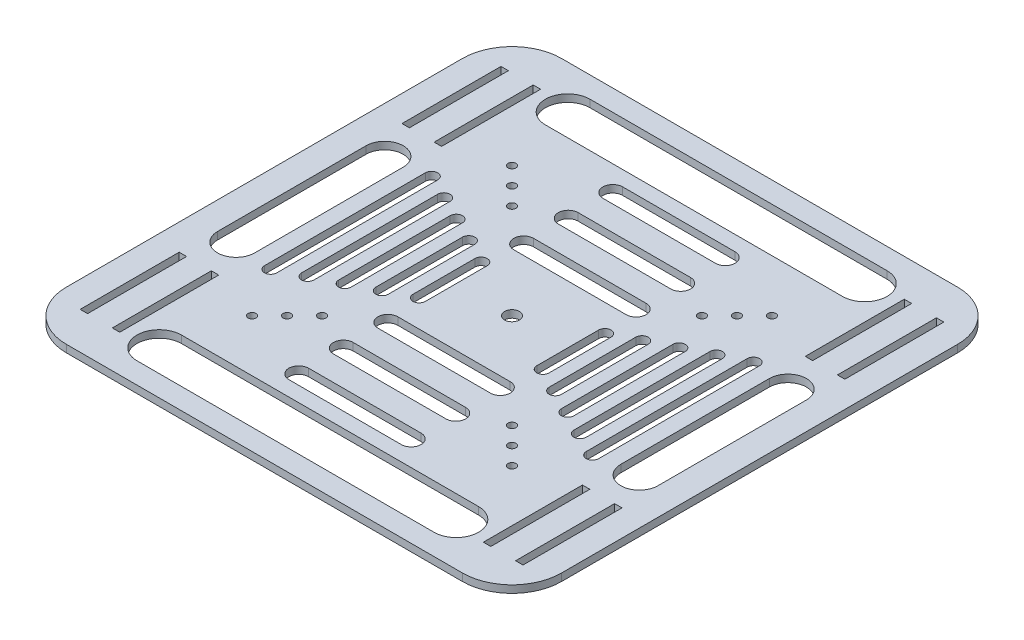
from build123d import *

# Parameters (mm, degrees)
SKETCH_2_W      = 200
SKETCH_2_H      = 200
SKETCH_2_R      = 1.6
SKETCH_2_R_2    = 3
SKETCH_2_W_2    = 3
SKETCH_2_H_2    = 40
EXTRUDE_1_DEPTH = 3
FILLET_2_R      = 20


with BuildPart() as part:
    # 草图2 → 凸台-拉伸1 (new body)
    with BuildSketch(Plane(origin=(0, 0, 0), x_dir=(1, 0, 0), z_dir=(0, 1, 0))):
        Rectangle(SKETCH_2_W, SKETCH_2_H)
        with Locations(Location((-52.5, 52.5, 0), (0, 0, 270))):
            Circle(SKETCH_2_R, mode=Mode.SUBTRACT)
        with Locations(Location((-45.428932188, 45.428932188, 0), (0, 0, 270))):
            Circle(SKETCH_2_R, mode=Mode.SUBTRACT)
        with Locations(Location((-38.357864376, 38.357864376, 0), (0, 0, 270))):
            Circle(SKETCH_2_R, mode=Mode.SUBTRACT)
        with Locations(Location((52.5, 52.5, 0), (0, 0, 270))):
            Circle(SKETCH_2_R, mode=Mode.SUBTRACT)
        with Locations(Location((45.428932188, 45.428932188, 0), (0, 0, 270))):
            Circle(SKETCH_2_R, mode=Mode.SUBTRACT)
        with Locations(Location((38.357864376, 38.357864376, 0), (0, 0, 270))):
            Circle(SKETCH_2_R, mode=Mode.SUBTRACT)
        with Locations(Location((52.5, -52.5, 0), (0, 0, 270))):
            Circle(SKETCH_2_R, mode=Mode.SUBTRACT)
        with Locations(Location((45.428932188, -45.428932188, 0), (0, 0, 270))):
            Circle(SKETCH_2_R, mode=Mode.SUBTRACT)
        with Locations(Location((38.357864376, -38.357864376, 0), (0, 0, 270))):
            Circle(SKETCH_2_R, mode=Mode.SUBTRACT)
        with Locations(Location((-52.5, -52.5, 0), (0, 0, 270))):
            Circle(SKETCH_2_R, mode=Mode.SUBTRACT)
        with Locations(Location((-45.428932188, -45.428932188, 0), (0, 0, 270))):
            Circle(SKETCH_2_R, mode=Mode.SUBTRACT)
        with Locations(Location((-38.357864376, -38.357864376, 0), (0, 0, 270))):
            Circle(SKETCH_2_R, mode=Mode.SUBTRACT)
        with Locations(Location((0, 0, 0), (0, 0, 270))):
            Circle(SKETCH_2_R_2, mode=Mode.SUBTRACT)
        with BuildLine():
            Line((-60, 73.5), (60, 73.5))
            ThreePointArc((60, 73.5), (69, 82.5), (60, 91.5))
            Line((60, 91.5), (-60, 91.5))
            ThreePointArc((-60, 91.5), (-69, 82.5), (-60, 73.5))
        make_face(mode=Mode.SUBTRACT)
        with BuildLine():
            Line((-60, -73.5), (60, -73.5))
            ThreePointArc((60, -73.5), (69, -82.5), (60, -91.5))
            Line((60, -91.5), (-60, -91.5))
            ThreePointArc((-60, -91.5), (-69, -82.5), (-60, -73.5))
        make_face(mode=Mode.SUBTRACT)
        with Locations((74.942911166, 65)):
            Rectangle(SKETCH_2_W_2, SKETCH_2_H_2, mode=Mode.SUBTRACT)
        with Locations((87.942911166, 65)):
            Rectangle(SKETCH_2_W_2, SKETCH_2_H_2, mode=Mode.SUBTRACT)
        with Locations((74.942911166, -65)):
            Rectangle(SKETCH_2_W_2, SKETCH_2_H_2, mode=Mode.SUBTRACT)
        with Locations((87.942911166, -65)):
            Rectangle(SKETCH_2_W_2, SKETCH_2_H_2, mode=Mode.SUBTRACT)
        with Locations((-74.942911166, -65)):
            Rectangle(SKETCH_2_W_2, SKETCH_2_H_2, mode=Mode.SUBTRACT)
        with Locations((-87.942911166, -65)):
            Rectangle(SKETCH_2_W_2, SKETCH_2_H_2, mode=Mode.SUBTRACT)
        with Locations((-87.942911166, 65)):
            Rectangle(SKETCH_2_W_2, SKETCH_2_H_2, mode=Mode.SUBTRACT)
        with Locations((-74.942911166, 65)):
            Rectangle(SKETCH_2_W_2, SKETCH_2_H_2, mode=Mode.SUBTRACT)
        with BuildLine():
            Line((22.714466094, 23.428932188), (-22.714466094, 23.428932188))
            ThreePointArc((-22.714466094, 23.428932188), (-26.714466094, 27.428932188), (-22.714466094, 31.428932188))
            Line((-22.714466094, 31.428932188), (22.714466094, 31.428932188))
            ThreePointArc((22.714466094, 31.428932188), (26.714466094, 27.428932188), (22.714466094, 23.428932188))
        make_face(mode=Mode.SUBTRACT)
        with BuildLine():
            Line((22.714466094, 41.428932188), (-22.714466094, 41.428932188))
            ThreePointArc((-22.714466094, 41.428932188), (-26.714466094, 45.428932188), (-22.714466094, 49.428932188))
            Line((-22.714466094, 49.428932188), (22.714466094, 49.428932188))
            ThreePointArc((22.714466094, 49.428932188), (26.714466094, 45.428932188), (22.714466094, 41.428932188))
        make_face(mode=Mode.SUBTRACT)
        with BuildLine():
            Line((22.714466094, 59.428932188), (-22.714466094, 59.428932188))
            ThreePointArc((-22.714466094, 59.428932188), (-26.714466094, 63.428932188), (-22.714466094, 67.428932188))
            Line((-22.714466094, 67.428932188), (22.714466094, 67.428932188))
            ThreePointArc((22.714466094, 67.428932188), (26.714466094, 63.428932188), (22.714466094, 59.428932188))
        make_face(mode=Mode.SUBTRACT)
        with BuildLine():
            Line((22.714466094, -23.428932188), (-22.714466094, -23.428932188))
            ThreePointArc((-22.714466094, -23.428932188), (-26.714466094, -27.428932188), (-22.714466094, -31.428932188))
            Line((-22.714466094, -31.428932188), (22.714466094, -31.428932188))
            ThreePointArc((22.714466094, -31.428932188), (26.714466094, -27.428932188), (22.714466094, -23.428932188))
        make_face(mode=Mode.SUBTRACT)
        with BuildLine():
            Line((22.714466094, -41.428932188), (-22.714466094, -41.428932188))
            ThreePointArc((-22.714466094, -41.428932188), (-26.714466094, -45.428932188), (-22.714466094, -49.428932188))
            Line((-22.714466094, -49.428932188), (22.714466094, -49.428932188))
            ThreePointArc((22.714466094, -49.428932188), (26.714466094, -45.428932188), (22.714466094, -41.428932188))
        make_face(mode=Mode.SUBTRACT)
        with BuildLine():
            Line((22.714466094, -59.428932188), (-22.714466094, -59.428932188))
            ThreePointArc((-22.714466094, -59.428932188), (-26.714466094, -63.428932188), (-22.714466094, -67.428932188))
            Line((-22.714466094, -67.428932188), (22.714466094, -67.428932188))
            ThreePointArc((22.714466094, -67.428932188), (26.714466094, -63.428932188), (22.714466094, -59.428932188))
        make_face(mode=Mode.SUBTRACT)
        with BuildLine():
            Line((22.5, -12.5), (22.5, 12.5))
            ThreePointArc((22.5, 12.5), (25, 15), (27.5, 12.5))
            Line((27.5, 12.5), (27.5, -12.5))
            ThreePointArc((27.5, -12.5), (25, -15), (22.5, -12.5))
        make_face(mode=Mode.SUBTRACT)
        with BuildLine():
            Line((32.5, -17.5), (32.5, 17.5))
            ThreePointArc((32.5, 17.5), (35, 20), (37.5, 17.5))
            Line((37.5, 17.5), (37.5, -17.5))
            ThreePointArc((37.5, -17.5), (35, -20), (32.5, -17.5))
        make_face(mode=Mode.SUBTRACT)
        with BuildLine():
            Line((42.5, -22.5), (42.5, 22.5))
            ThreePointArc((42.5, 22.5), (45, 25), (47.5, 22.5))
            Line((47.5, 22.5), (47.5, -22.5))
            ThreePointArc((47.5, -22.5), (45, -25), (42.5, -22.5))
        make_face(mode=Mode.SUBTRACT)
        with BuildLine():
            Line((52.5, -27.5), (52.5, 27.5))
            ThreePointArc((52.5, 27.5), (55, 30), (57.5, 27.5))
            Line((57.5, 27.5), (57.5, -27.5))
            ThreePointArc((57.5, -27.5), (55, -30), (52.5, -27.5))
        make_face(mode=Mode.SUBTRACT)
        with BuildLine():
            Line((62.5, -32.5), (62.5, 32.5))
            ThreePointArc((62.5, 32.5), (65, 35), (67.5, 32.5))
            Line((67.5, 32.5), (67.5, -32.5))
            ThreePointArc((67.5, -32.5), (65, -35), (62.5, -32.5))
        make_face(mode=Mode.SUBTRACT)
        with BuildLine():
            Line((-22.5, -12.5), (-22.5, 12.5))
            ThreePointArc((-22.5, 12.5), (-25, 15), (-27.5, 12.5))
            Line((-27.5, 12.5), (-27.5, -12.5))
            ThreePointArc((-27.5, -12.5), (-25, -15), (-22.5, -12.5))
        make_face(mode=Mode.SUBTRACT)
        with BuildLine():
            Line((-32.5, -17.5), (-32.5, 17.5))
            ThreePointArc((-32.5, 17.5), (-35, 20), (-37.5, 17.5))
            Line((-37.5, 17.5), (-37.5, -17.5))
            ThreePointArc((-37.5, -17.5), (-35, -20), (-32.5, -17.5))
        make_face(mode=Mode.SUBTRACT)
        with BuildLine():
            Line((-42.5, -22.5), (-42.5, 22.5))
            ThreePointArc((-42.5, 22.5), (-45, 25), (-47.5, 22.5))
            Line((-47.5, 22.5), (-47.5, -22.5))
            ThreePointArc((-47.5, -22.5), (-45, -25), (-42.5, -22.5))
        make_face(mode=Mode.SUBTRACT)
        with BuildLine():
            Line((-52.5, -27.5), (-52.5, 27.5))
            ThreePointArc((-52.5, 27.5), (-55, 30), (-57.5, 27.5))
            Line((-57.5, 27.5), (-57.5, -27.5))
            ThreePointArc((-57.5, -27.5), (-55, -30), (-52.5, -27.5))
        make_face(mode=Mode.SUBTRACT)
        with BuildLine():
            Line((-62.5, -32.5), (-62.5, 32.5))
            ThreePointArc((-62.5, 32.5), (-65, 35), (-67.5, 32.5))
            Line((-67.5, 32.5), (-67.5, -32.5))
            ThreePointArc((-67.5, -32.5), (-65, -35), (-62.5, -32.5))
        make_face(mode=Mode.SUBTRACT)
        with BuildLine():
            Line((88.942911166, 30), (88.942911166, -30))
            ThreePointArc((88.942911166, -30), (81.442911166, -37.5), (73.942911166, -30))
            Line((73.942911166, -30), (73.942911166, 30))
            ThreePointArc((73.942911166, 30), (81.442911166, 37.5), (88.942911166, 30))
        make_face(mode=Mode.SUBTRACT)
        with BuildLine():
            Line((-88.942911166, 30), (-88.942911166, -30))
            ThreePointArc((-88.942911166, -30), (-81.442911166, -37.5), (-73.942911166, -30))
            Line((-73.942911166, -30), (-73.942911166, 30))
            ThreePointArc((-73.942911166, 30), (-81.442911166, 37.5), (-88.942911166, 30))
        make_face(mode=Mode.SUBTRACT)
    extrude(amount=EXTRUDE_1_DEPTH)

    # 圆角2
    fillet_2_edges = [part.edges().sort_by_distance(p)[0] for p in [
        (-100, 1.5, -100),
        (100, 1.5, -100),
        (100, 1.5, 100),
        (-100, 1.5, 100),
    ]]
    fillet(fillet_2_edges, radius=FILLET_2_R)


solid = part.part
